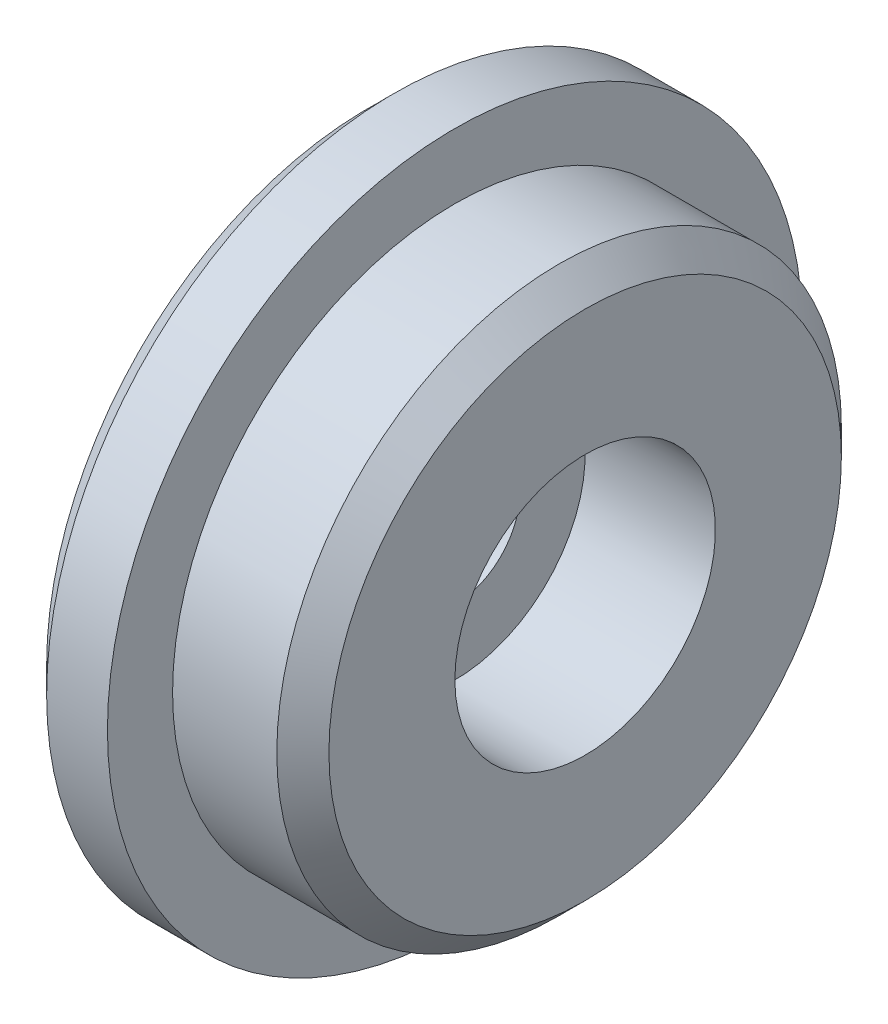
from build123d import *

# Parameters (mm, degrees)
CHAMFER1_SIZE = 1.905


with BuildPart() as part:
    # Sketch1 → Revolve1 (revolve)
    with BuildSketch(Plane.XY, mode=Mode.PRIVATE) as revolve1_sk:
        Polygon((-0.600085911, -4.7625), (-0.600085911, -25.4), (5.749914089, -25.4), (5.749914089, -20.6375), (15.274914089, -20.6375), (15.274914089, -9.525), (5.749914089, -9.525), (5.749914089, -4.7625), align=None)
    revolve(revolve1_sk.sketch.rotate(Axis((0, 0, 0), (1, 0, 0)), 270), axis=Axis((0, 0, 0), (1, 0, 0)))

    # Chamfer1
    chamfer1_edges = [part.edges().sort_by_distance(p)[0] for p in [
        (15.274914089, 0, -20.6375),
        (-0.600085911, 0, -25.4),
    ]]
    chamfer(chamfer1_edges, length=CHAMFER1_SIZE)


solid = part.part
